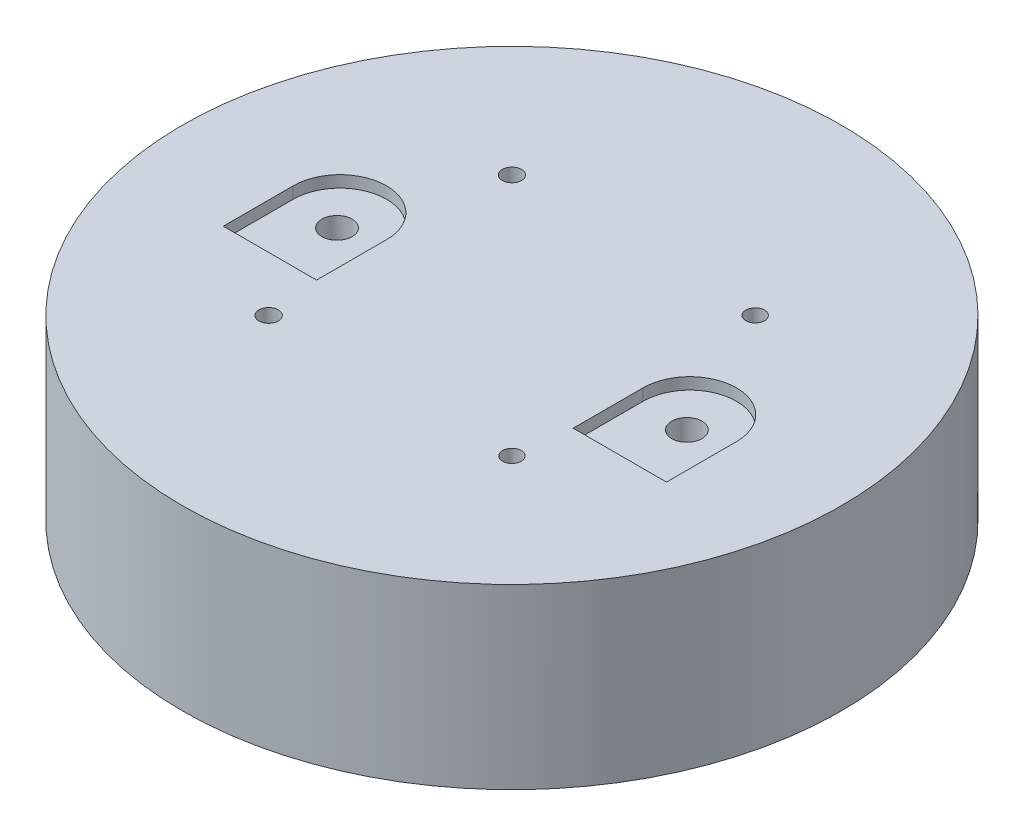
from build123d import *

# Parameters (mm, degrees)
SKETCH2_R                = 56.515
SKETCH2_R_2              = 51.435
BOSS_EXTRUDE1_DEPTH      = 15.24
SKETCH2_R_3              = 47.201666667
SKETCH2_R_4              = 42.121666667
BOSS_EXTRUDE1_2_DEPTH    = 15.24
SKETCH3_R                = 56.515
BOSS_EXTRUDE2_DEPTH      = 15.24
CUT_EXTRUDE1_DEPTH       = 86.539001923
CUT_EXTRUDE1_DEPTH_BACK  = 86.539001923
SKETCH4_R                = 1.6
SKETCH4_R_2              = 1.65876763
SKETCH4_R_3              = 1.651
SKETCH14_R               = 10
CUT_EXTRUDE7_DEPTH       = 19.558
SKETCH16_W               = 1.27
SKETCH16_H               = 1.27
EXTRUDE_THIN1_DEPTH      = 15.24
SKETCH20_R               = 66.675
SKETCH20_R_2             = 56.515
CUT_EXTRUDE_THIN3_DEPTH  = 15.748
CUT_EXTRUDE12_DEPTH      = 15.748
SKETCH32_R               = 2.6
CUT_EXTRUDE18_DEPTH      = 2
CUT_EXTRUDE19_DEPTH      = 86.539002091
CUT_EXTRUDE19_DEPTH_BACK = 86.539002091
SKETCH33_R               = 2.6
SKETCH34_R               = 6
CUT_EXTRUDE20_DEPTH      = 5


with BuildPart() as part:
    # Sketch2 → Boss-Extrude1 (new body)
    with BuildSketch(Plane(origin=(0, 0, 0), x_dir=(1, 0, 0), z_dir=(0, 1, 0))):
        with Locations(Location((0, 0, 0), (0, 0, 90))):
            Circle(SKETCH2_R)
        with Locations(Location((0, 0, 0), (0, 0, 90))):
            Circle(SKETCH2_R_2, mode=Mode.SUBTRACT)
    extrude(amount=BOSS_EXTRUDE1_DEPTH)



with BuildPart() as body_2:
    # Sketch2 → Boss-Extrude1 2 (new body)
    with BuildSketch(Plane(origin=(0, 0, 0), x_dir=(1, 0, 0), z_dir=(0, 1, 0))):
        with Locations(Location((0, 0, 0), (0, 0, 90))):
            Circle(SKETCH2_R_3)
        with Locations(Location((0, 0, 0), (0, 0, 90))):
            Circle(SKETCH2_R_4, mode=Mode.SUBTRACT)
    extrude(amount=BOSS_EXTRUDE1_2_DEPTH)


with BuildPart() as part_1:
    add(part.part)

    add(body_2.part)  # Boss-Extrude2 merges body 2
    # Sketch3 → Boss-Extrude2 (add)
    with BuildSketch(Plane(origin=(0, 15.24, 0), x_dir=(1, 0, 0), z_dir=(0, 1, 0))):
        with Locations(Location((0, 0, 0), (0, 0, 90))):
            Circle(SKETCH3_R)
    extrude(amount=BOSS_EXTRUDE2_DEPTH)

    # Sketch4 → Cut-Extrude1 (cut, two sides: drawn at the far end of the back side and taken through both)
    with BuildSketch(Plane(origin=(0, 30.48, 0), x_dir=(1, 0, 0), z_dir=(0, 1, 0)).offset(-CUT_EXTRUDE1_DEPTH_BACK)):
        with Locations(Location((20.859650045, 20.859650045, 0), (0, 0, 270))):
            Circle(SKETCH4_R)
        with Locations(Location((20.859650045, -20.859650045, 0), (0, 0, 270))):
            Circle(SKETCH4_R)
        with Locations(Location((-20.859650045, -20.859650045, 0), (0, 0, 270))):
            Circle(SKETCH4_R_2)
        with Locations(Location((-20.859650045, 20.859650045, 0), (0, 0, 270))):
            Circle(SKETCH4_R_3)
    extrude(amount=CUT_EXTRUDE1_DEPTH + CUT_EXTRUDE1_DEPTH_BACK, mode=Mode.SUBTRACT)

    # Sketch14 → Cut-Extrude7 (cut)
    with BuildSketch(Plane.XY.offset(-56.515)):
        with Locations((0, 5.08)):
            Circle(SKETCH14_R)
    extrude(amount=CUT_EXTRUDE7_DEPTH, mode=Mode.SUBTRACT)

    # Sketch16 → Extrude-Thin1 (add)
    # profile 1 of 2: a face of its own
    with BuildSketch(Plane.XY.offset(-56.515)):
        with Locations((-0.635, 0.635)):
            Rectangle(SKETCH16_W, SKETCH16_H)
    # profile 2 of 2: a face of its own
    with BuildSketch(Plane.XY.offset(-56.515)):
        with BuildLine():
            Line((10.060144134, 0), (-10.060144134, 0))
            ThreePointArc((-10.060144134, 0), (0, 16.35), (10.060144134, 0))
        make_face()
        with BuildLine():
            Line((9.245750375, 1.27), (-9.245750375, 1.27))
            ThreePointArc((-9.245750375, 1.27), (0, 15.08), (9.245750375, 1.27))
        make_face(mode=Mode.SUBTRACT)
    extrude(amount=EXTRUDE_THIN1_DEPTH)

    # Sketch20 → Cut-Extrude-Thin3 (cut)
    with BuildSketch(Plane(origin=(0, 0, 0), x_dir=(-1, 0, 0), z_dir=(0, -1, 0))):
        Circle(SKETCH20_R)
        Circle(SKETCH20_R_2, mode=Mode.SUBTRACT)
    extrude(amount=-CUT_EXTRUDE_THIN3_DEPTH, mode=Mode.SUBTRACT)

    # Sketch21 → Cut-Extrude12 (cut)
    with BuildSketch(Plane.XY.offset(-56.515)):
        Polygon((-9.303733138, 0), (-9.245750375, 1.27), (9.245750375, 1.27), (9.245750375, 0), align=None)
    extrude(amount=CUT_EXTRUDE12_DEPTH, mode=Mode.SUBTRACT)

    # Sketch32 → Cut-Extrude18 (cut)
    # profile 1 of 2: a face of its own
    with BuildSketch(Plane(origin=(0, 30.48, 0), x_dir=(1, 0, 0), z_dir=(0, 1, 0))):
        with BuildLine():
            Line((-22, 0.5), (-22, -11.5))
            Line((-22, -11.5), (-38, -11.5))
            Line((-38, -11.5), (-38, 0.5))
            ThreePointArc((-38, 0.5), (-30, 8.5), (-22, 0.5))
        make_face()
        with Locations(Location((-30, 0, 0), (0, 0, 270))):
            Circle(SKETCH32_R, mode=Mode.SUBTRACT)
    # profile 2 of 2: a face of its own
    with BuildSketch(Plane(origin=(0, 30.48, 0), x_dir=(1, 0, 0), z_dir=(0, 1, 0))):
        with BuildLine():
            Line((38, 0.5), (38, -11.5))
            Line((38, -11.5), (22, -11.5))
            Line((22, -11.5), (22, 0.5))
            ThreePointArc((22, 0.5), (30, 8.5), (38, 0.5))
        make_face()
        with Locations(Location((30, 0, 0), (0, 0, 90))):
            Circle(SKETCH32_R, mode=Mode.SUBTRACT)
    extrude(amount=-CUT_EXTRUDE18_DEPTH, mode=Mode.SUBTRACT)

    # Sketch33 → Cut-Extrude19 (cut, two sides: drawn at the far end of the back side and taken through both)
    with BuildSketch(Plane(origin=(0, 30.48, 0), x_dir=(1, 0, 0), z_dir=(0, 1, 0)).offset(-CUT_EXTRUDE19_DEPTH_BACK)):
        with Locations(Location((-30, 0, 0), (0, 0, 270))):
            Circle(SKETCH33_R)
        with Locations(Location((30, 0, 0), (0, 0, 270))):
            Circle(SKETCH33_R)
    extrude(amount=CUT_EXTRUDE19_DEPTH + CUT_EXTRUDE19_DEPTH_BACK, mode=Mode.SUBTRACT)

    # Sketch34 → Cut-Extrude20 (cut)
    with BuildSketch(Plane(origin=(0, 15.24, 0), x_dir=(-1, 0, 0), z_dir=(0, -1, 0))):
        with Locations(Location((30, 0, 0), (0, 0, 90))):
            Circle(SKETCH34_R)
        with Locations(Location((-30, 0, 0), (0, 0, 90))):
            Circle(SKETCH34_R)
    extrude(amount=-CUT_EXTRUDE20_DEPTH, mode=Mode.SUBTRACT)


solid = part_1.part
